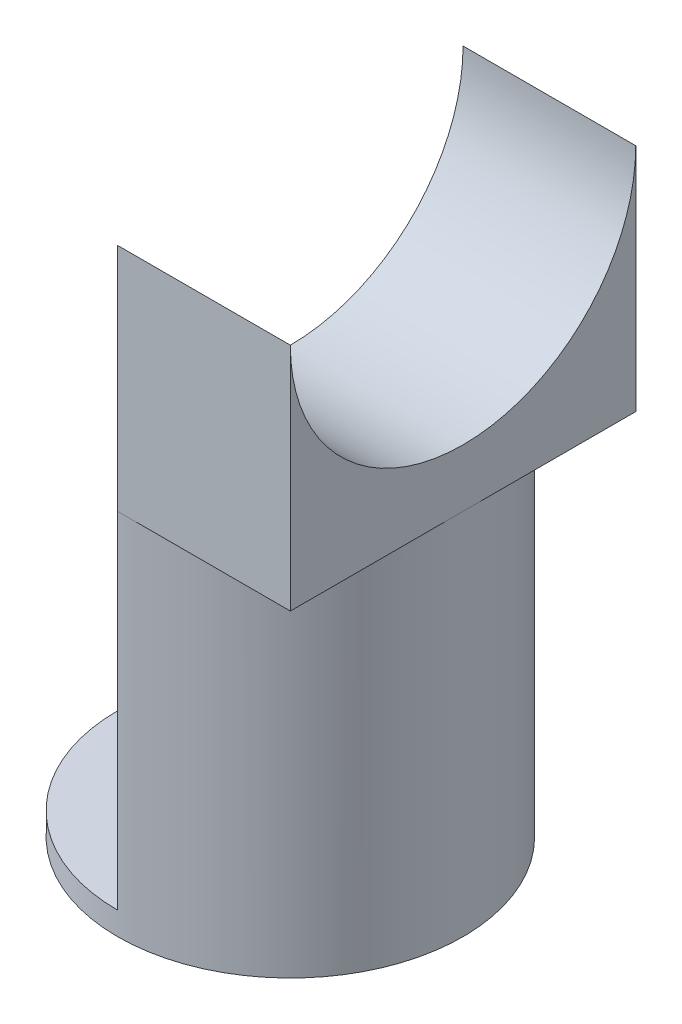
from build123d import *

# Parameters (mm, degrees)
SKETCH1_R           = 75
BOSS_EXTRUDE1_DEPTH = 10
BOSS_EXTRUDE5_DEPTH = 150
SKETCH13_W          = 75
SKETCH13_H          = 150
BOSS_EXTRUDE6_DEPTH = 100
SKETCH14_R          = 75
CUT_EXTRUDE5_DEPTH  = 100


with BuildPart() as part:
    # Sketch1 → Boss-Extrude1 (new body)
    with BuildSketch(Plane(origin=(0, 0, 0), x_dir=(1, 0, 0), z_dir=(0, 1, 0))):
        with Locations(Location((0, 0, 0), (0, 0, 270))):
            Circle(SKETCH1_R)
    extrude(amount=BOSS_EXTRUDE1_DEPTH)

    # Sketch12 → Boss-Extrude5 (add)
    with BuildSketch(Plane(origin=(0, 10, 0), x_dir=(1, 0, 0), z_dir=(0, 1, 0))):
        with BuildLine():
            Line((0, 75), (0, -75))
            ThreePointArc((0, -75), (75, 0), (0, 75))
        make_face()
    extrude(amount=BOSS_EXTRUDE5_DEPTH)

    # Sketch13 → Boss-Extrude6 (add)
    with BuildSketch(Plane(origin=(0, 160, 0), x_dir=(1, 0, 0), z_dir=(0, 1, 0))):
        with Locations((37.5, 0)):
            Rectangle(SKETCH13_W, SKETCH13_H)
    extrude(amount=BOSS_EXTRUDE6_DEPTH)

    # Sketch14 → Cut-Extrude5 (cut)
    with BuildSketch(Plane.ZY):
        with Locations((0, 260)):
            Circle(SKETCH14_R)
    extrude(amount=-CUT_EXTRUDE5_DEPTH, mode=Mode.SUBTRACT)


solid = part.part
